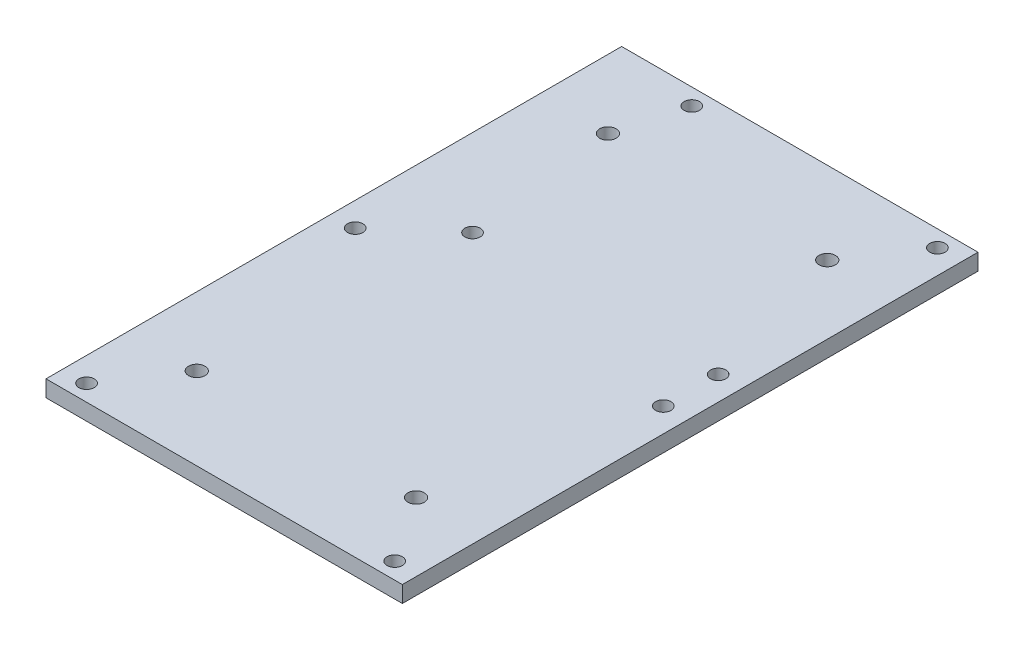
from build123d import *

# Parameters (mm, degrees)
SKETCH_1_W          = 65
SKETCH_1_H          = 105
EXTRUDE_1_DEPTH     = 3
SKETCH_2_R          = 1.4
CUT_EXTRUDE_1_DEPTH = 62.818282085
SKETCH_3_R          = 1.4
CUT_EXTRUDE_2_DEPTH = 62.818282085
SKETCH_6_R          = 1.5
CUT_EXTRUDE_5_DEPTH = 62.818282085


with BuildPart() as part:
    # 草图1 → 凸台-拉伸1 (new body)
    with BuildSketch(Plane(origin=(0, 0, 0), x_dir=(1, 0, 0), z_dir=(0, 1, 0))):
        Rectangle(SKETCH_1_W, SKETCH_1_H)
    extrude(amount=EXTRUDE_1_DEPTH)

    # 草图2 → 切除-拉伸1 (cut, through all)
    with BuildSketch(Plane(origin=(0, 3, 0), x_dir=(1, 0, 0), z_dir=(0, 1, 0))):
        with Locations(Location((-28.1, -49.5, 0), (0, 0, 270))):
            Circle(SKETCH_2_R)
        with Locations(Location((28.1, -49.5, 0), (0, 0, 270))):
            Circle(SKETCH_2_R)
        with Locations(Location((28.1, -0.5, 0), (0, 0, 270))):
            Circle(SKETCH_2_R)
        with Locations(Location((-28.1, -0.5, 0), (0, 0, 270))):
            Circle(SKETCH_2_R)
    extrude(amount=-CUT_EXTRUDE_1_DEPTH, mode=Mode.SUBTRACT)

    # 草图3 → 切除-拉伸2 (cut, through all)
    with BuildSketch(Plane(origin=(0, 3, 0), x_dir=(1, 0, 0), z_dir=(0, 1, 0))):
        with Locations(Location((-16.7, 9.5, 0), (0, 0, 270))):
            Circle(SKETCH_3_R)
        with Locations(Location((28.1, 9.5, 0), (0, 0, 270))):
            Circle(SKETCH_3_R)
        with Locations(Location((28.1, 49.5, 0), (0, 0, 270))):
            Circle(SKETCH_3_R)
        with Locations(Location((-16.7, 49.5, 0), (0, 0, 270))):
            Circle(SKETCH_3_R)
    extrude(amount=-CUT_EXTRUDE_2_DEPTH, mode=Mode.SUBTRACT)

    # 草图6 → 切除-拉伸5 (cut, through all)
    with BuildSketch(Plane(origin=(0, 3, 0), x_dir=(1, 0, 0), z_dir=(0, 1, 0))):
        with Locations(Location((-20, -37.5, 0), (0, 0, 270))):
            Circle(SKETCH_6_R)
        with Locations(Location((20, -37.5, 0), (0, 0, 270))):
            Circle(SKETCH_6_R)
        with Locations(Location((20, 37.5, 0), (0, 0, 270))):
            Circle(SKETCH_6_R)
        with Locations(Location((-20, 37.5, 0), (0, 0, 270))):
            Circle(SKETCH_6_R)
    extrude(amount=-CUT_EXTRUDE_5_DEPTH, mode=Mode.SUBTRACT)


solid = part.part
